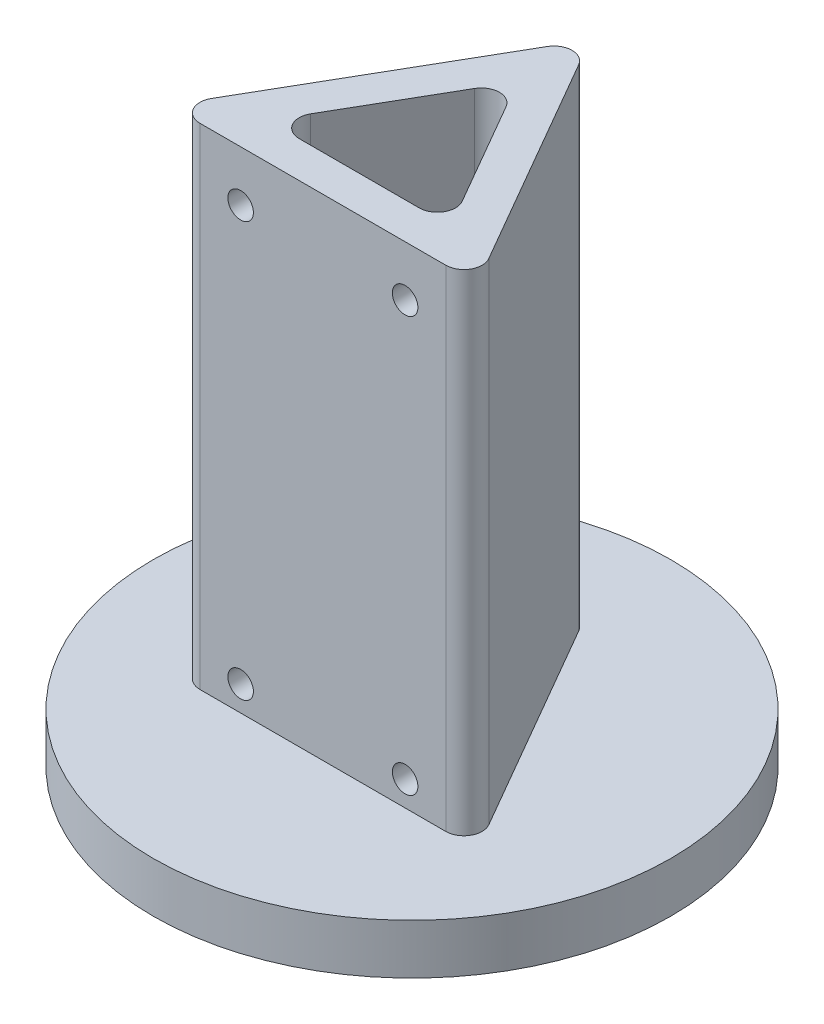
from build123d import *

# Parameters (mm, degrees)
SKETCH1_R                           = 36.195
BOSS_EXTRUDE1_DEPTH                 = 7
CUT_EXTRUDE1_REACH                  = 53.664
SKETCH2_R                           = 6.35
BOSS_EXTRUDE2_DEPTH                 = 68.58
FILLET1_R                           = 2.54
F_9_64_0_14063_DIAMETER_HOLE1_D     = 3.572002
F_9_64_0_14063_DIAMETER_HOLE1_DEPTH = 5.5999888
F_9_64_0_14063_DIAMETER_HOLE1_TIP   = 1.073137666
F_9_64_0_14063_DIAMETER_HOLE2_D     = 3.572002
F_9_64_0_14063_DIAMETER_HOLE2_DEPTH = 5.588
F_9_64_0_14063_DIAMETER_HOLE2_TIP   = 1.073137666


with BuildPart() as part:
    # Sketch1 → Boss-Extrude1 (new body)
    with BuildSketch(Plane(origin=(0, 0, 0), x_dir=(1, 0, 0), z_dir=(0, 1, 0))):
        Circle(SKETCH1_R)
    extrude(amount=-BOSS_EXTRUDE1_DEPTH)

    # Sketch2 → Cut-Extrude1 (cut, up to next)
    with BuildSketch(Plane.XZ.offset(7), mode=Mode.PRIVATE) as cut_extrude1_sk1:
        Circle(SKETCH2_R)
    cut_extrude1_tool1 = extrude(cut_extrude1_sk1.sketch, amount=-CUT_EXTRUDE1_REACH, mode=Mode.PRIVATE) & part.part
    add(cut_extrude1_tool1.solids().sort_by_distance((0, -7, 0))[0], mode=Mode.SUBTRACT)

    # Sketch3 → Boss-Extrude2 (add)
    with BuildSketch(Plane(origin=(0, 0, 0), x_dir=(1, 0, 0), z_dir=(0, 1, 0))):
        Polygon((0, 24.929984624), (-21.59, -12.464992312), (21.59, -12.464992312), align=None)
        Polygon((12.791181898, -7.384992312), (0, 14.769984624), (-12.791181898, -7.384992312), align=None, mode=Mode.SUBTRACT)
    extrude(amount=BOSS_EXTRUDE2_DEPTH)

    # Fillet1
    fillet1_edges = [part.edges().sort_by_distance(p)[0] for p in [
        (-12.791181898, 34.29, 7.384992312),
        (12.791181898, 34.29, 7.384992312),
        (0, 34.29, -14.769984624),
        (0, 34.29, -24.929984624),
        (21.59, 34.29, 12.464992312),
        (-21.59, 34.29, 12.464992312),
    ]]
    fillet(fillet1_edges, radius=FILLET1_R)

    # 9/64 (0.14063) Diameter Hole1
    with Locations(Plane.XY.offset(12.464992312)):
        with Locations((-11.5, 61.5), (11.5, 61.5), (-11.5, 3.5), (11.5, 3.5)):
            Hole(F_9_64_0_14063_DIAMETER_HOLE1_D / 2, depth=F_9_64_0_14063_DIAMETER_HOLE1_DEPTH)
            with Locations((0, 0, -(F_9_64_0_14063_DIAMETER_HOLE1_DEPTH + F_9_64_0_14063_DIAMETER_HOLE1_TIP / 2))):  # 118° drill point
                Cone(0, F_9_64_0_14063_DIAMETER_HOLE1_D / 2, F_9_64_0_14063_DIAMETER_HOLE1_TIP, mode=Mode.SUBTRACT)

    # 9/64 (0.14063) Diameter Hole2
    with Locations(Plane(origin=(0, -7, 0), x_dir=(-1, 0, 0), z_dir=(0, -1, 0))):
        with Locations((-19.05, 0), (19.05, 0)):
            Hole(F_9_64_0_14063_DIAMETER_HOLE2_D / 2, depth=F_9_64_0_14063_DIAMETER_HOLE2_DEPTH)
            with Locations((0, 0, -(F_9_64_0_14063_DIAMETER_HOLE2_DEPTH + F_9_64_0_14063_DIAMETER_HOLE2_TIP / 2))):  # 118° drill point
                Cone(0, F_9_64_0_14063_DIAMETER_HOLE2_D / 2, F_9_64_0_14063_DIAMETER_HOLE2_TIP, mode=Mode.SUBTRACT)


solid = part.part
